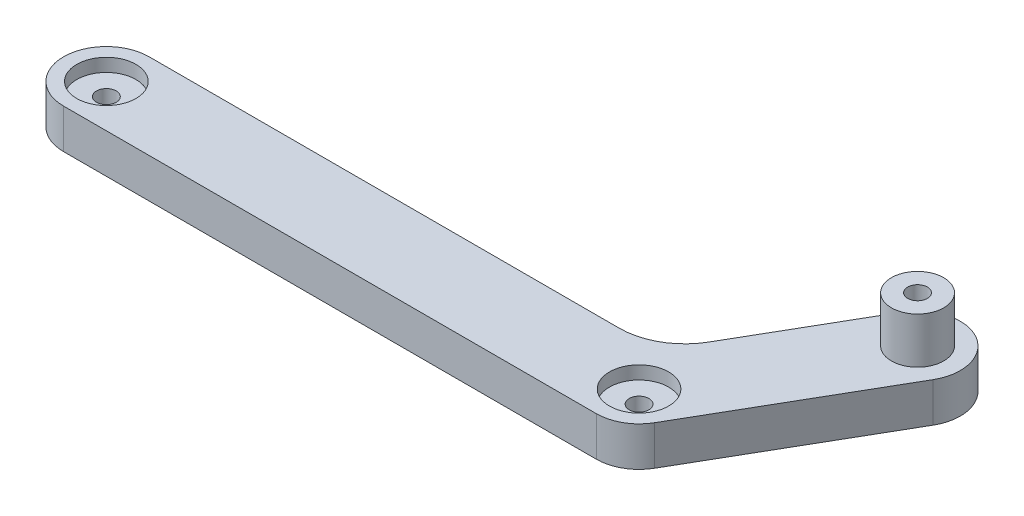
from build123d import *

# Parameters (mm, degrees)
SKETCH1_R           = 1.5
BOSS_EXTRUDE1_DEPTH = 6
SKETCH2_R           = 4.5
CUT_EXTRUDE1_DEPTH  = 2
SKETCH3_R           = 3.975
SKETCH3_R_2         = 1.5
BOSS_EXTRUDE2_DEPTH = 7


with BuildPart() as part:
    # Sketch1 → Boss-Extrude1 (new body)
    with BuildSketch(Plane(origin=(0, 0, 0), x_dir=(1, 0, 0), z_dir=(0, 1, 0))):
        with BuildLine():
            Line((0, 6.5), (71.473720558, 6.5))
            ThreePointArc((71.473720558, 6.5), (76.473720558, 7.839745962), (80.133974596, 11.5))
            Line((80.133974596, 11.5), (90.870834875, 30.096787517))
            ThreePointArc((90.870834875, 30.096787517), (99.75, 32.475952642), (102.129165125, 23.596787517))
            Line((102.129165125, 23.596787517), (86.629165125, -3.25))
            ThreePointArc((86.629165125, -3.25), (84.25, -5.629165125), (81, -6.5))
            Line((81, -6.5), (0, -6.5))
            ThreePointArc((0, -6.5), (-6.5, 0), (0, 6.5))
        make_face()
        with Locations(Location((0, 0, 0), (0, 0, 270))):
            Circle(SKETCH1_R, mode=Mode.SUBTRACT)
        with Locations(Location((81, 0, 0), (0, 0, 270))):
            Circle(SKETCH1_R, mode=Mode.SUBTRACT)
        with Locations(Location((96.5, 26.846787517, 0), (0, 0, 270))):
            Circle(SKETCH1_R, mode=Mode.SUBTRACT)
    extrude(amount=BOSS_EXTRUDE1_DEPTH)

    # Sketch2 → Cut-Extrude1 (cut)
    with BuildSketch(Plane(origin=(0, 6, 0), x_dir=(1, 0, 0), z_dir=(0, 1, 0))):
        with Locations(Location((0, 0, 0), (0, 0, 270))):
            Circle(SKETCH2_R)
        with Locations(Location((81, 0, 0), (0, 0, 270))):
            Circle(SKETCH2_R)
    extrude(amount=-CUT_EXTRUDE1_DEPTH, mode=Mode.SUBTRACT)

    # Sketch3 → Boss-Extrude2 (add)
    with BuildSketch(Plane(origin=(0, 6, 0), x_dir=(1, 0, 0), z_dir=(0, 1, 0))):
        with Locations(Location((96.5, 26.846787517, 0), (0, 0, 270))):
            Circle(SKETCH3_R)
        with Locations(Location((96.5, 26.846787517, 0), (0, 0, 270))):
            Circle(SKETCH3_R_2, mode=Mode.SUBTRACT)
    extrude(amount=BOSS_EXTRUDE2_DEPTH)


solid = part.part
